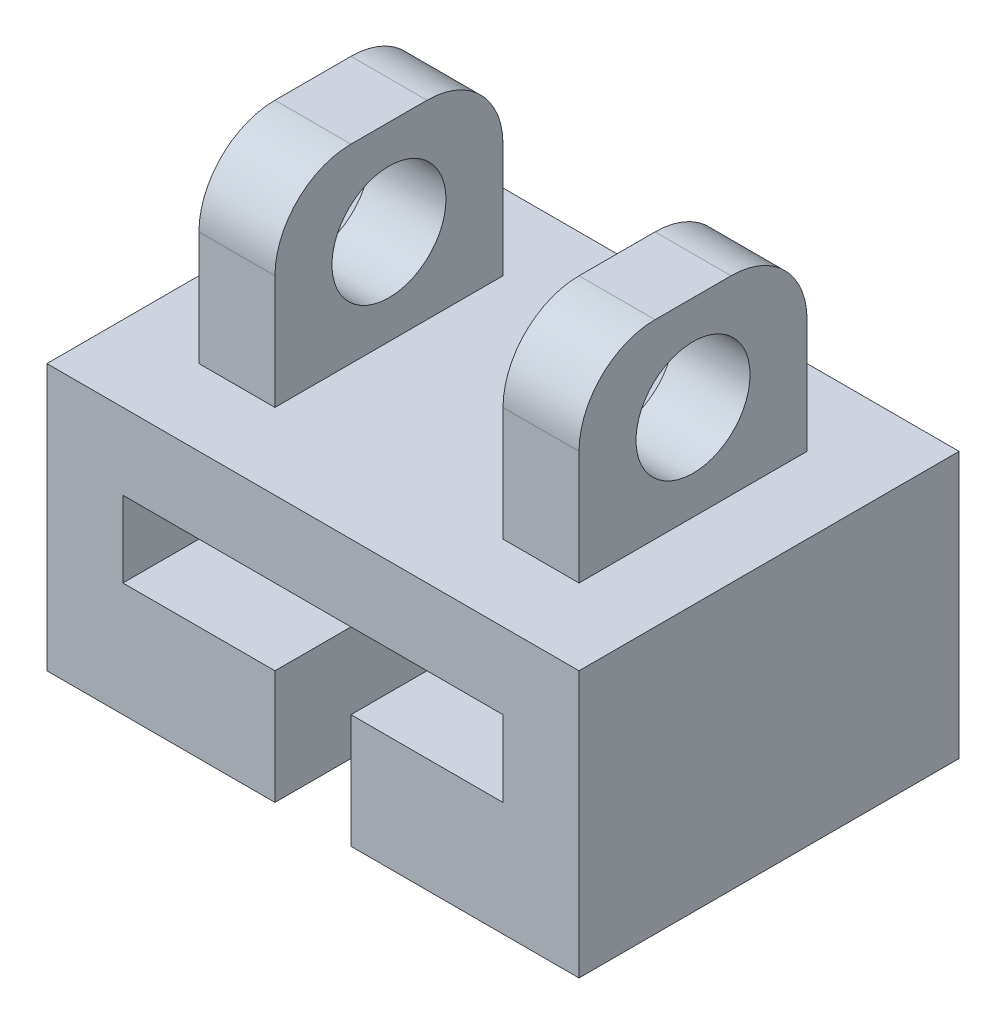
from build123d import *

# Parameters (mm, degrees)
BOSS_EXTRUDE1_DEPTH = 100
SKETCH3_W           = 20
SKETCH3_H           = 60
BOSS_EXTRUDE2_DEPTH = 50
FILLET1_R           = 20
SKETCH4_R           = 15
CUT_EXTRUDE1_DEPTH  = 100


with BuildPart() as part:
    # Sketch2 → Boss-Extrude1 (new body)
    with BuildSketch(Plane.XY):
        Polygon((-80.866204042, 3.693693694), (59.133795958, 3.693693694), (59.133795958, -13.693693694), (59.133795958, -66.306306306), (38.267591916, -66.306306306), (-0.866204042, -66.306306306), (-0.866204042, -36.306306306), (39.133795958, -36.306306306), (39.133795958, -16.306306306), (-60.866204042, -16.306306306), (-60.866204042, -36.306306306), (-20.866204042, -36.306306306), (-20.866204042, -66.306306306), (-60, -66.306306306), (-80.866204042, -66.306306306), (-80.866204042, -13.693693694), align=None)
    extrude(amount=BOSS_EXTRUDE1_DEPTH)

    # Sketch3 → Boss-Extrude2 (add)
    with BuildSketch(Plane(origin=(0, 3.693693694, 0), x_dir=(1, 0, 0), z_dir=(0, 1, 0))):
        with Locations((-50.866204042, -50)):
            Rectangle(SKETCH3_W, SKETCH3_H)
        with Locations((29.133795958, -50)):
            Rectangle(SKETCH3_W, SKETCH3_H)
    extrude(amount=BOSS_EXTRUDE2_DEPTH)

    # Fillet1
    fillet1_edges = [part.edges().sort_by_distance(p)[0] for p in [
        (-50.866204042, 53.693693694, 20),
        (-50.866204042, 53.693693694, 80),
        (29.133795958, 53.693693694, 20),
        (29.133795958, 53.693693694, 80),
    ]]
    fillet(fillet1_edges, radius=FILLET1_R)

    # Sketch4 → Cut-Extrude1 (cut)
    with BuildSketch(Plane(origin=(39.133795958, 0, 0), x_dir=(0, 0, -1), z_dir=(1, 0, 0))):
        with Locations((-50, 28.693693694)):
            Circle(SKETCH4_R)
    extrude(amount=-CUT_EXTRUDE1_DEPTH, mode=Mode.SUBTRACT)


solid = part.part
